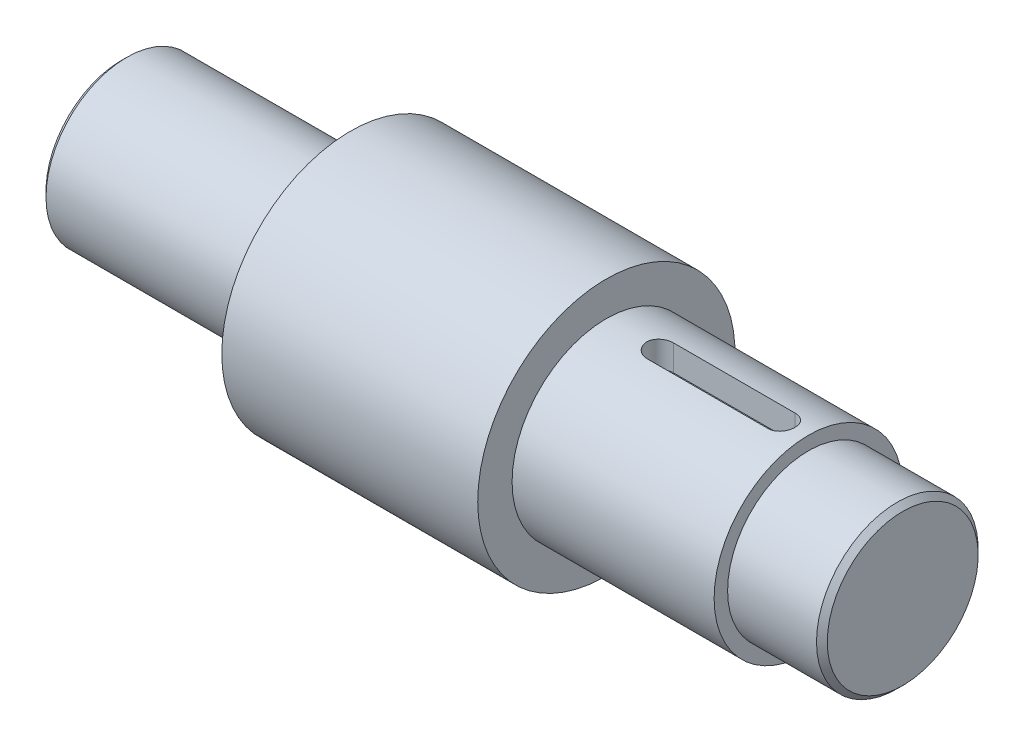
from build123d import *

# Parameters (mm, degrees)
CHAFL_N1_SIZE         = 2
CORTAR_EXTRUIR1_DEPTH = 10


with BuildPart() as part:
    # Croquis1 → Revolución1 (revolve)
    with BuildSketch(Plane.XY, mode=Mode.PRIVATE) as revoluci_n1_sk:
        Polygon((0, 0), (290, 0), (290, 30), (255, 30), (255, 35), (180, 35), (180, 47.75), (85, 47.75), (85, 30), (0, 30), align=None)
    revolve(revoluci_n1_sk.sketch.rotate(Axis((0, 0, 0), (1, 0, 0)), 90), axis=Axis((0, 0, 0), (1, 0, 0)))

    # Chaflán1
    chafl_n1_edges = [part.edges().sort_by_distance(p)[0] for p in [
        (290, 0, -30),
        (0, 0, -30),
    ]]
    chamfer(chafl_n1_edges, length=CHAFL_N1_SIZE)

    # Croquis2 → Cortar-Extruir1 (cut)
    with BuildSketch(Plane(origin=(30.68575842, 35, 0), x_dir=(1, 0, 0), z_dir=(0, 1, 0))):
        with BuildLine():
            Line((169.31424158, -5), (214.31424158, -5))
            ThreePointArc((214.31424158, -5), (219.31424158, 0), (214.31424158, 5))
            Line((214.31424158, 5), (169.31424158, 5))
            ThreePointArc((169.31424158, 5), (164.31424158, 0), (169.31424158, -5))
        make_face()
    extrude(amount=-CORTAR_EXTRUIR1_DEPTH, mode=Mode.SUBTRACT)


solid = part.part
